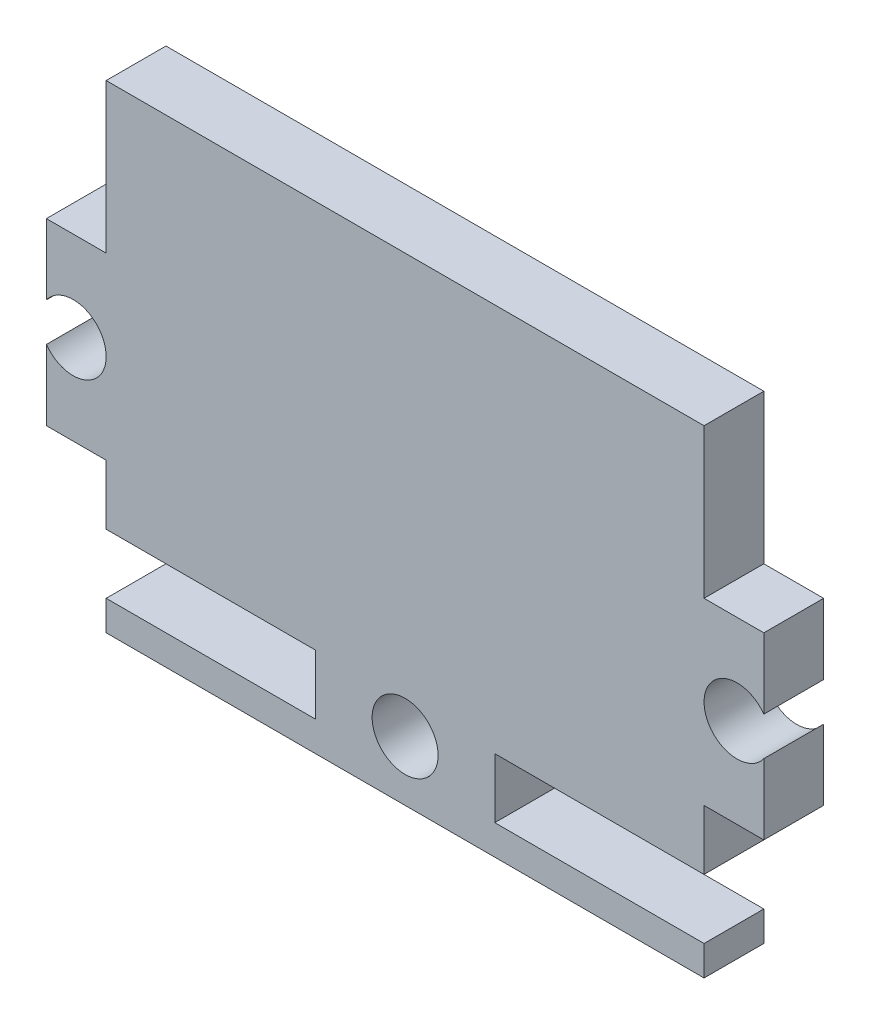
from build123d import *

# Parameters (mm, degrees)
SKETCH1_R           = 1.7526
BOSS_EXTRUDE1_DEPTH = 3.175


with BuildPart() as part:
    # Sketch1 → Boss-Extrude1 (new body)
    with BuildSketch(Plane.XY):
        with BuildLine():
            Line((3.175, 1.5875), (3.175, 0))
            Line((3.175, 0), (34.925, 0))
            Line((34.925, 0), (34.925, 1.5875))
            Line((34.925, 1.5875), (23.8125, 1.5875))
            Line((23.8125, 1.5875), (23.8125, 4.7625))
            Line((23.8125, 4.7625), (34.925, 4.7625))
            Line((34.925, 4.7625), (34.925, 7.9375))
            Line((34.925, 7.9375), (38.1, 7.9375))
            Line((38.1, 7.9375), (38.1, 11.676093266))
            ThreePointArc((38.1, 11.676093266), (34.925, 12.7), (38.1, 13.723906734))
            Line((38.1, 13.723906734), (38.1, 17.4625))
            Line((38.1, 17.4625), (34.925, 17.4625))
            Line((34.925, 17.4625), (34.925, 25.4))
            Line((34.925, 25.4), (3.175, 25.4))
            Line((3.175, 25.4), (3.175, 17.4625))
            Line((3.175, 17.4625), (0, 17.4625))
            Line((0, 17.4625), (0, 13.723906734))
            ThreePointArc((0, 13.723906734), (3.175, 12.7), (0, 11.676093266))
            Line((0, 11.676093266), (0, 7.9375))
            Line((0, 7.9375), (3.175, 7.9375))
            Line((3.175, 7.9375), (3.175, 4.7625))
            Line((3.175, 4.7625), (14.2875, 4.7625))
            Line((14.2875, 4.7625), (14.2875, 1.5875))
            Line((14.2875, 1.5875), (3.175, 1.5875))
        make_face()
        with Locations((19.05, 3.175)):
            Circle(SKETCH1_R, mode=Mode.SUBTRACT)
    extrude(amount=BOSS_EXTRUDE1_DEPTH)


solid = part.part
